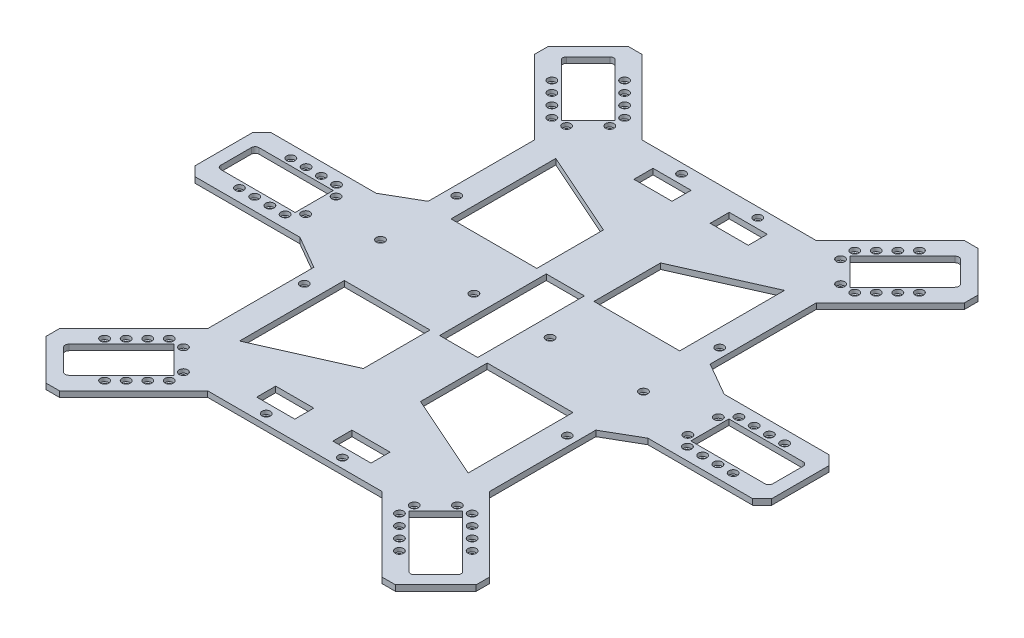
from build123d import *

# Parameters (mm, degrees)
EXTRUDE_1_DEPTH              = 3
CUT_EXTRUDE_1_REACH          = 217.134
HOLE_WIZARD_M2_2_D           = 2.4
HOLE_WIZARD_M2_2_CBORE_D     = 4.4
HOLE_WIZARD_M2_2_CBORE_DEPTH = 2
CUT_EXTRUDE_2_REACH          = 217.134
HOLE_WIZARD_M2_3_D           = 2.4
HOLE_WIZARD_M2_3_CBORE_D     = 4.4
HOLE_WIZARD_M2_3_CBORE_DEPTH = 2
MIRROR_7_COPY_1_REACH        = 217.134
MIRROR_7_COPY_2_D            = 2.4
MIRROR_7_COPY_2_CBORE_D      = 4.4
MIRROR_7_COPY_2_CBORE_DEPTH  = 2
CUT_EXTRUDE_3_REACH          = 217.134
SKETCH_18_W                  = 20
SKETCH_18_H                  = 10
HOLE_WIZARD_M2_4_D           = 2.4
HOLE_WIZARD_M2_4_CBORE_D     = 4.4
HOLE_WIZARD_M2_4_CBORE_DEPTH = 2
HOLE_WIZARD_M2_5_D           = 2.4
HOLE_WIZARD_M2_5_CBORE_D     = 4.4
HOLE_WIZARD_M2_5_CBORE_DEPTH = 2
HOLE_WIZARD_M2_6_D           = 2.4
HOLE_WIZARD_M2_6_CBORE_D     = 4.4
HOLE_WIZARD_M2_6_CBORE_DEPTH = 2
SKETCH_24_W                  = 20
SKETCH_24_H                  = 56
CUT_EXTRUDE_4_DEPTH          = 10
HOLE_WIZARD_M2_7_D           = 2.4
HOLE_WIZARD_M2_7_CBORE_D     = 4.4
HOLE_WIZARD_M2_7_CBORE_DEPTH = 2


with BuildPart() as part:
    # 草图1 → 凸台-拉伸1 (new body)
    with BuildSketch(Plane(origin=(0, 0, 0), x_dir=(1, 0, 0), z_dir=(0, 1, 0))):
        Polygon((-45.715728753, 114), (45.715728753, 114), (84.606601718, 152.890872965), (91.67766953, 152.890872965), (112.890872965, 131.67766953), (112.890872965, 124.606601718), (74, 85.715728753), (74, 30), (91.320508076, 20), (146.320508076, 20), (151.320508076, 15), (151.320508076, -15), (146.320508076, -20), (91.320508076, -20), (74, -30), (74, -85.715728753), (112.890872965, -124.606601718), (112.890872965, -131.67766953), (91.67766953, -152.890872965), (84.606601718, -152.890872965), (45.715728753, -114), (-45.715728753, -114), (-84.606601718, -152.890872965), (-91.67766953, -152.890872965), (-112.890872965, -131.67766953), (-112.890872965, -124.606601718), (-74, -85.715728753), (-74, -30), (-91.320508076, -20), (-146.320508076, -20), (-151.320508076, -15), (-151.320508076, 15), (-146.320508076, 20), (-91.320508076, 20), (-74, 30), (-74, 85.715728753), (-112.890872965, 124.606601718), (-112.890872965, 131.67766953), (-91.67766953, 152.890872965), (-84.606601718, 152.890872965), align=None)
    extrude(amount=EXTRUDE_1_DEPTH)

    # 草图2 → 切除-拉伸1 (cut, up to next)
    with BuildSketch(Plane(origin=(0, 3, 0), x_dir=(1, 0, 0), z_dir=(0, 1, 0)), mode=Mode.PRIVATE) as cut_extrude_1_sk1:
        with BuildLine():
            Line((103.820508076, -10), (103.820508076, 10))
            Line((103.820508076, 10), (142.820508076, 10))
            ThreePointArc((142.820508076, 10), (144.234721638, 9.414213562), (144.820508076, 8))
            Line((144.820508076, 8), (144.820508076, -8))
            ThreePointArc((144.820508076, -8), (144.234721638, -9.414213562), (142.820508076, -10))
            Line((142.820508076, -10), (103.820508076, -10))
        make_face()
    cut_extrude_1_tool1 = extrude(cut_extrude_1_sk1.sketch, amount=-CUT_EXTRUDE_1_REACH, mode=Mode.PRIVATE) & part.part
    cut_extrude_1 = cut_extrude_1_tool1.solids().sort_by_distance((124.278435, 3, 0))[0]
    add(cut_extrude_1, mode=Mode.SUBTRACT)

    # M2 凹头盖螺钉的柱形沉头孔2 (through all)
    with Locations(Plane(origin=(100.320508076, 3, -8), x_dir=(0, 0, 1), z_dir=(0, 1, 0))):
        with Locations((0, 0), (-5.5, 5.25), (-5.5, 13.25), (-5.5, 21.25), (-5.5, 29.25), (16, 0), (21.5, 5.25), (21.5, 13.25), (21.5, 21.25), (21.5, 29.25)):
            hole_wizard_m2_2 = CounterBoreHole(HOLE_WIZARD_M2_2_D / 2, HOLE_WIZARD_M2_2_CBORE_D / 2, HOLE_WIZARD_M2_2_CBORE_DEPTH)

    # 草图10 → 切除-拉伸2 (cut, up to next)
    with BuildSketch(Plane(origin=(0, 3, 0), x_dir=(1, 0, 0), z_dir=(0, 1, 0)), mode=Mode.PRIVATE) as cut_extrude_2_sk1:
        with BuildLine():
            Line((75.767766953, 101.625631329), (61.625631329, 115.767766953))
            Line((61.625631329, 115.767766953), (79.916185958, 134.058321582))
            Line((79.916185958, 134.058321582), (89.202795796, 143.344931419))
            ThreePointArc((89.202795796, 143.344931419), (90.617009358, 143.930717857), (92.03122292, 143.344931419))
            Line((92.03122292, 143.344931419), (97.68807717, 137.68807717))
            Line((97.68807717, 137.68807717), (103.344931419, 132.03122292))
            ThreePointArc((103.344931419, 132.03122292), (103.930717857, 130.617009358), (103.344931419, 129.202795796))
            Line((103.344931419, 129.202795796), (94.058321582, 119.916185958))
            Line((94.058321582, 119.916185958), (75.767766953, 101.625631329))
        make_face()
    cut_extrude_2_tool1 = extrude(cut_extrude_2_sk1.sketch, amount=-CUT_EXTRUDE_2_REACH, mode=Mode.PRIVATE) & part.part
    cut_extrude_2 = cut_extrude_2_tool1.solids().sort_by_distance((83.162638, 3, -123.162638))[0]
    add(cut_extrude_2, mode=Mode.SUBTRACT)

    # M2 凹头盖螺钉的柱形沉头孔3 (through all)
    with Locations(Plane(origin=(60.388194462, 3, -119.480077554), x_dir=(0, 0, 1), z_dir=(0, 1, 0))):
        with Locations((0, 0), (-5.65685425, 5.65685425), (-11.313708499, 11.313708499), (-16.970562749, 16.970562749), (7.601397898, 0.176776695), (18.915106397, 11.490485194), (19.091883092, 19.091883092), (13.435028842, 24.748737342), (7.778174593, 30.405591591), (2.121320343, 36.062445841)):
            hole_wizard_m2_3 = CounterBoreHole(HOLE_WIZARD_M2_3_D / 2, HOLE_WIZARD_M2_3_CBORE_D / 2, HOLE_WIZARD_M2_3_CBORE_DEPTH)

    # 镜向5: 切除-拉伸1, M2 凹头盖螺钉的柱形沉头孔2 across plane
    add(cut_extrude_1.mirror(Plane(origin=(0, 0, 0), x_dir=(0, 0, 1), z_dir=(1, 0, 0))), mode=Mode.SUBTRACT)
    add(hole_wizard_m2_2.mirror(Plane(origin=(0, 0, 0), x_dir=(0, 0, 1), z_dir=(1, 0, 0))), mode=Mode.SUBTRACT)

    # 镜向6: 切除-拉伸2, M2 凹头盖螺钉的柱形沉头孔3 across plane
    add(cut_extrude_2.mirror(Plane(origin=(0, 0, 0), x_dir=(0, 0, 1), z_dir=(1, 0, 0))), mode=Mode.SUBTRACT)
    add(hole_wizard_m2_3.mirror(Plane(origin=(0, 0, 0), x_dir=(0, 0, 1), z_dir=(1, 0, 0))), mode=Mode.SUBTRACT)

    # 镜向7: 切除-拉伸2, M2 凹头盖螺钉的柱形沉头孔3 across plane
    add(cut_extrude_2.mirror(Plane.XY), mode=Mode.SUBTRACT)
    add(hole_wizard_m2_3.mirror(Plane.XY), mode=Mode.SUBTRACT)

    # 镜向7 copy 1 sketch → 镜向7 copy 1 (cut, up to next)
    with BuildSketch(Plane(origin=(0, 3, 0), x_dir=(-1, 0, 0), z_dir=(0, 1, 0)), mode=Mode.PRIVATE) as mirror_7_copy_1_sk1:
        with BuildLine():
            Line((75.767766953, 101.625631329), (61.625631329, 115.767766953))
            Line((61.625631329, 115.767766953), (79.916185958, 134.058321582))
            Line((79.916185958, 134.058321582), (89.202795796, 143.344931419))
            ThreePointArc((89.202795796, 143.344931419), (90.617009358, 143.930717857), (92.03122292, 143.344931419))
            Line((92.03122292, 143.344931419), (97.68807717, 137.68807717))
            Line((97.68807717, 137.68807717), (103.344931419, 132.03122292))
            ThreePointArc((103.344931419, 132.03122292), (103.930717857, 130.617009358), (103.344931419, 129.202795796))
            Line((103.344931419, 129.202795796), (94.058321582, 119.916185958))
            Line((94.058321582, 119.916185958), (75.767766953, 101.625631329))
        make_face()
    mirror_7_copy_1_tool1 = extrude(mirror_7_copy_1_sk1.sketch, amount=-MIRROR_7_COPY_1_REACH, mode=Mode.PRIVATE) & part.part
    add(mirror_7_copy_1_tool1.solids().sort_by_distance((-83.162638, 3, 123.162638))[0], mode=Mode.SUBTRACT)

    # 镜向7 copy 2 (through all)
    with Locations(Plane(origin=(-60.388194462, 3, 119.480077554), x_dir=(0, 0, -1), z_dir=(0, 1, 0))):
        with Locations((0, 0), (-5.65685425, 5.65685425), (-11.313708499, 11.313708499), (-16.970562749, 16.970562749), (7.601397898, 0.176776695), (18.915106397, 11.490485194), (19.091883092, 19.091883092), (13.435028842, 24.748737342), (7.778174593, 30.405591591), (2.121320343, 36.062445841)):
            CounterBoreHole(MIRROR_7_COPY_2_D / 2, MIRROR_7_COPY_2_CBORE_D / 2, MIRROR_7_COPY_2_CBORE_DEPTH)

    # 草图18 → 切除-拉伸3 (cut, up to next)
    with BuildSketch(Plane(origin=(0, 3, 0), x_dir=(1, 0, 0), z_dir=(0, 1, 0)), mode=Mode.PRIVATE) as cut_extrude_3_sk1:
        Polygon((-60, -28), (-15, -28), (-15, -63), (-60, -83), align=None)
    cut_extrude_3_tool1 = extrude(cut_extrude_3_sk1.sketch, amount=-CUT_EXTRUDE_3_REACH, mode=Mode.PRIVATE) & part.part
    # 草图18 → 切除-拉伸3 (cut, up to next)
    with BuildSketch(Plane(origin=(0, 3, 0), x_dir=(1, 0, 0), z_dir=(0, 1, 0)), mode=Mode.PRIVATE) as cut_extrude_3_sk2:
        with Locations((20, -99)):
            Rectangle(SKETCH_18_W, SKETCH_18_H)
    cut_extrude_3_tool2 = extrude(cut_extrude_3_sk2.sketch, amount=-CUT_EXTRUDE_3_REACH, mode=Mode.PRIVATE) & part.part
    # 草图18 → 切除-拉伸3 (cut, up to next)
    with BuildSketch(Plane(origin=(0, 3, 0), x_dir=(1, 0, 0), z_dir=(0, 1, 0)), mode=Mode.PRIVATE) as cut_extrude_3_sk3:
        with Locations((-20, -99)):
            Rectangle(SKETCH_18_W, SKETCH_18_H)
    cut_extrude_3_tool3 = extrude(cut_extrude_3_sk3.sketch, amount=-CUT_EXTRUDE_3_REACH, mode=Mode.PRIVATE) & part.part
    # 草图18 → 切除-拉伸3 (cut, up to next)
    with BuildSketch(Plane(origin=(0, 3, 0), x_dir=(1, 0, 0), z_dir=(0, 1, 0)), mode=Mode.PRIVATE) as cut_extrude_3_sk4:
        Polygon((15, -63), (60, -83), (60, -28), (15, -28), align=None)
    cut_extrude_3_tool4 = extrude(cut_extrude_3_sk4.sketch, amount=-CUT_EXTRUDE_3_REACH, mode=Mode.PRIVATE) & part.part
    # 草图18 → 切除-拉伸3 (cut, up to next)
    with BuildSketch(Plane(origin=(0, 3, 0), x_dir=(1, 0, 0), z_dir=(0, 1, 0)), mode=Mode.PRIVATE) as cut_extrude_3_sk5:
        with Locations((-20, 99)):
            Rectangle(SKETCH_18_W, SKETCH_18_H)
    cut_extrude_3_tool5 = extrude(cut_extrude_3_sk5.sketch, amount=-CUT_EXTRUDE_3_REACH, mode=Mode.PRIVATE) & part.part
    # 草图18 → 切除-拉伸3 (cut, up to next)
    with BuildSketch(Plane(origin=(0, 3, 0), x_dir=(1, 0, 0), z_dir=(0, 1, 0)), mode=Mode.PRIVATE) as cut_extrude_3_sk6:
        with Locations((20, 99)):
            Rectangle(SKETCH_18_W, SKETCH_18_H)
    cut_extrude_3_tool6 = extrude(cut_extrude_3_sk6.sketch, amount=-CUT_EXTRUDE_3_REACH, mode=Mode.PRIVATE) & part.part
    # 草图18 → 切除-拉伸3 (cut, up to next)
    with BuildSketch(Plane(origin=(0, 3, 0), x_dir=(1, 0, 0), z_dir=(0, 1, 0)), mode=Mode.PRIVATE) as cut_extrude_3_sk7:
        Polygon((15, 63), (60, 83), (60, 28), (15, 28), align=None)
    cut_extrude_3_tool7 = extrude(cut_extrude_3_sk7.sketch, amount=-CUT_EXTRUDE_3_REACH, mode=Mode.PRIVATE) & part.part
    # 草图18 → 切除-拉伸3 (cut, up to next)
    with BuildSketch(Plane(origin=(0, 3, 0), x_dir=(1, 0, 0), z_dir=(0, 1, 0)), mode=Mode.PRIVATE) as cut_extrude_3_sk8:
        Polygon((-15, 28), (-15, 63), (-60, 83), (-60, 28), align=None)
    cut_extrude_3_tool8 = extrude(cut_extrude_3_sk8.sketch, amount=-CUT_EXTRUDE_3_REACH, mode=Mode.PRIVATE) & part.part
    add(cut_extrude_3_tool1.solids().sort_by_distance((-39.166667, 3, 50.87037))[0], mode=Mode.SUBTRACT)
    add(cut_extrude_3_tool2.solids().sort_by_distance((20, 3, 99))[0], mode=Mode.SUBTRACT)
    add(cut_extrude_3_tool3.solids().sort_by_distance((-20, 3, 99))[0], mode=Mode.SUBTRACT)
    add(cut_extrude_3_tool4.solids().sort_by_distance((39.166667, 3, 50.87037))[0], mode=Mode.SUBTRACT)
    add(cut_extrude_3_tool5.solids().sort_by_distance((-20, 3, -99))[0], mode=Mode.SUBTRACT)
    add(cut_extrude_3_tool6.solids().sort_by_distance((20, 3, -99))[0], mode=Mode.SUBTRACT)
    add(cut_extrude_3_tool7.solids().sort_by_distance((39.166667, 3, -50.87037))[0], mode=Mode.SUBTRACT)
    add(cut_extrude_3_tool8.solids().sort_by_distance((-39.166667, 3, -50.87037))[0], mode=Mode.SUBTRACT)

    # M2 凹头盖螺钉的柱形沉头孔4 (through all)
    with Locations(Plane(origin=(-20, 3, 109), x_dir=(0, 0, 1), z_dir=(0, 1, 0))):
        with Locations((0, 0), (0, 40), (-218, 0), (-218, 40)):
            CounterBoreHole(HOLE_WIZARD_M2_4_D / 2, HOLE_WIZARD_M2_4_CBORE_D / 2, HOLE_WIZARD_M2_4_CBORE_DEPTH)

    # M2 凹头盖螺钉的柱形沉头孔5 (through all)
    with Locations(Plane(origin=(-69, 3, -40), x_dir=(0, 0, 1), z_dir=(0, 1, 0))):
        with Locations((0, 0), (0, 138)):
            hole_wizard_m2_5 = CounterBoreHole(HOLE_WIZARD_M2_5_D / 2, HOLE_WIZARD_M2_5_CBORE_D / 2, HOLE_WIZARD_M2_5_CBORE_DEPTH)

    # 镜向8: M2 凹头盖螺钉的柱形沉头孔5 across plane
    add(hole_wizard_m2_5.mirror(Plane.XY), mode=Mode.SUBTRACT)

    # M2 凹头盖螺钉的柱形沉头孔6 (through all)
    with Locations(Plane(origin=(-69, 3, 0), x_dir=(0, 0, 1), z_dir=(0, 1, 0))):
        with Locations((0, 0), (0, 138)):
            CounterBoreHole(HOLE_WIZARD_M2_6_D / 2, HOLE_WIZARD_M2_6_CBORE_D / 2, HOLE_WIZARD_M2_6_CBORE_DEPTH)

    # 草图24 → 切除-拉伸4 (cut)
    with BuildSketch(Plane(origin=(0, 3, 0), x_dir=(1, 0, 0), z_dir=(0, 1, 0))):
        Rectangle(SKETCH_24_W, SKETCH_24_H)
    extrude(amount=-CUT_EXTRUDE_4_DEPTH, mode=Mode.SUBTRACT)

    # M2 凹头盖螺钉的柱形沉头孔7 (through all)
    with Locations(Plane(origin=(-20, 3, 0), x_dir=(0, 0, 1), z_dir=(0, 1, 0))):
        with Locations((0, 0), (0, 40)):
            CounterBoreHole(HOLE_WIZARD_M2_7_D / 2, HOLE_WIZARD_M2_7_CBORE_D / 2, HOLE_WIZARD_M2_7_CBORE_DEPTH)


solid = part.part
